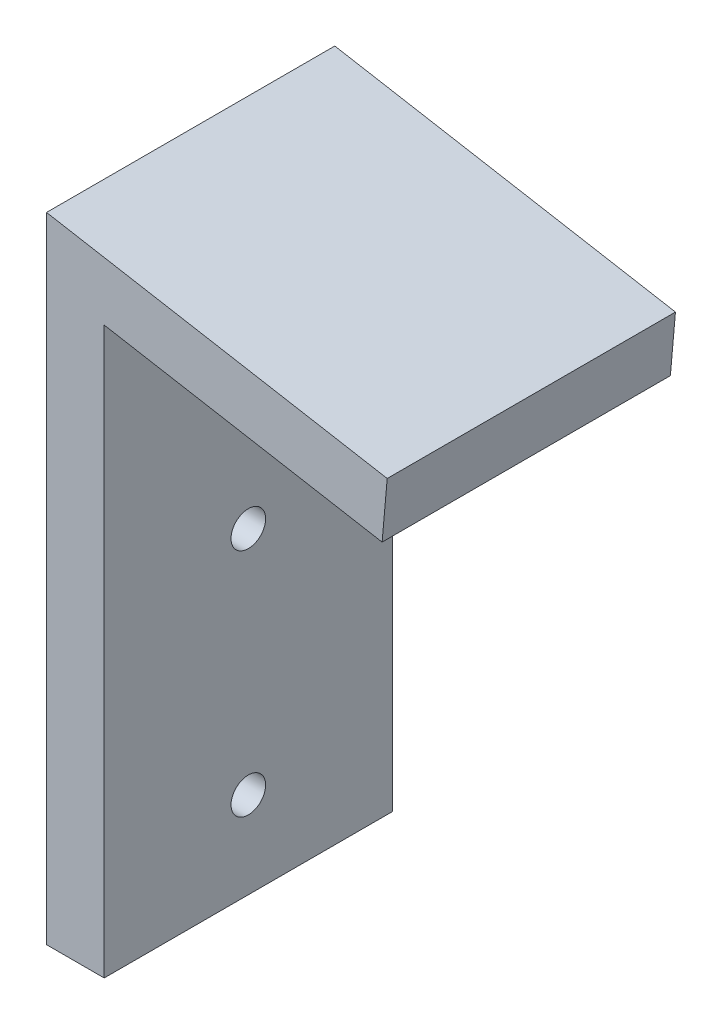
from build123d import *

# Parameters (mm, degrees)
BOSS_EXTRU_1_DEPTH      = 50
ESQUISSE2_R             = 3
ENL_V_MAT_EXTRU_1_DEPTH = 10


with BuildPart() as part:
    # Esquisse1 → Boss.-Extru.1 (new body)
    with BuildSketch(Plane.XY):
        Polygon((0, 0), (0, -110), (10, -110), (10, -11.917535926), (58.206757919, -20.417687999), (59.088465181, -10.41889066), align=None)
    extrude(amount=BOSS_EXTRU_1_DEPTH)

    # Esquisse2 → Enlèv. mat.-Extru.1 (cut)
    with BuildSketch(Plane.ZY):
        with Locations(Location((25, -95, 0), (0, 0, 270))):
            Circle(ESQUISSE2_R)
        with Locations(Location((25, -55, 0), (0, 0, 270))):
            Circle(ESQUISSE2_R)
    extrude(amount=-ENL_V_MAT_EXTRU_1_DEPTH, mode=Mode.SUBTRACT)


solid = part.part
